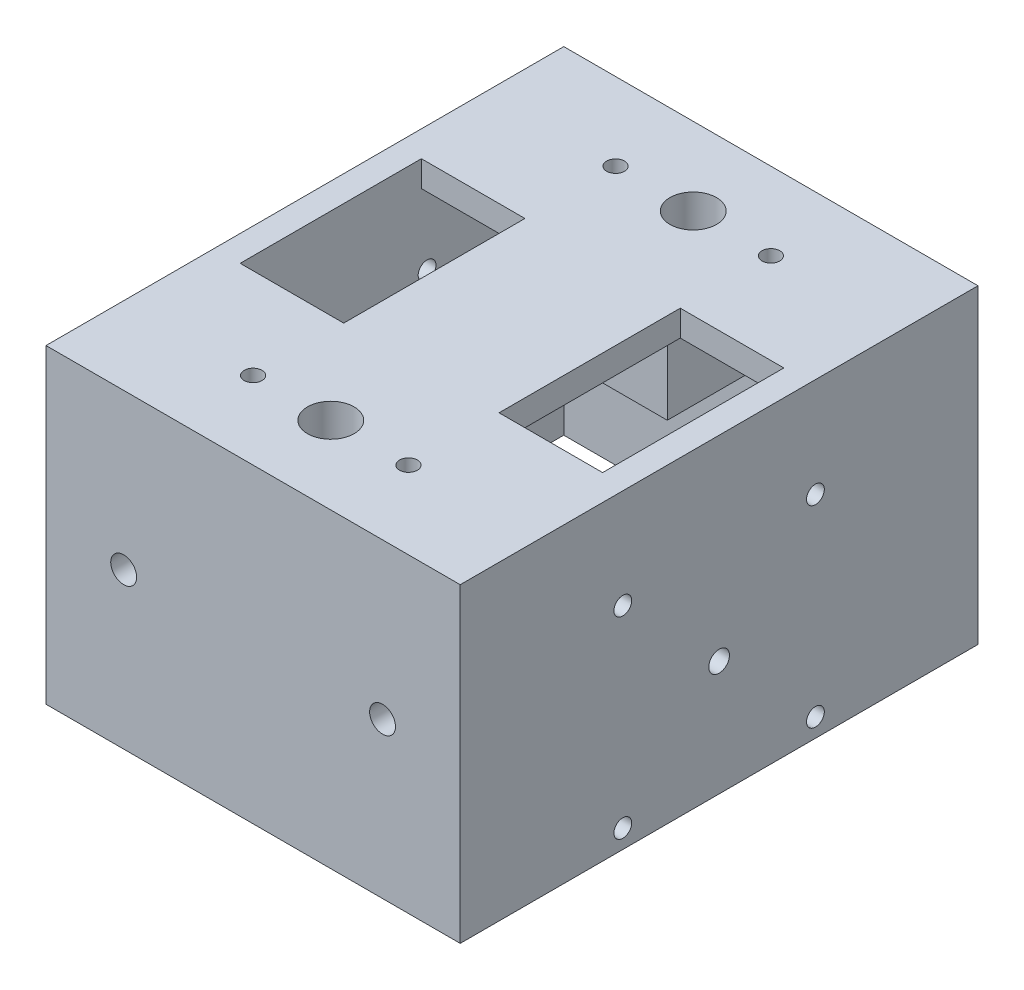
from build123d import *

# Parameters (mm, degrees)
SKETCH2_W                            = 101.6
SKETCH2_H                            = 127
BOSS_EXTRUDE1_DEPTH                  = 76.2
SHELL1_T                             = -6.35
F_11_64_0_17188_DIAMETER_HOLE1_D     = 4.365752
F_11_64_0_17188_DIAMETER_HOLE1_DEPTH = 25.4
F_11_64_0_17188_DIAMETER_HOLE1_TIP   = 1.311604225
SKETCH4_R                            = 5.715
CUT_EXTRUDE2_DEPTH                   = 112.44204772
SKETCH6_W                            = 19.05
SKETCH6_H                            = 28.575
SKETCH6_R                            = 5.715
BOSS_EXTRUDE2_DEPTH                  = 25.4
F_11_64_0_17188_DIAMETER_HOLE2_D     = 4.365752
F_11_64_0_17188_DIAMETER_HOLE2_DEPTH = 127
F_11_64_0_17188_DIAMETER_HOLE2_TIP   = 1.311604225
CUT_EXTRUDE3_REACH                   = 143.99
SKETCH9_R                            = 3.81
SKETCH10_W                           = 25.4
SKETCH10_H                           = 44.45
CUT_EXTRUDE5_DEPTH                   = 108.200338152
SKETCH11_R                           = 3.175
CUT_EXTRUDE6_DEPTH                   = 157.576115675
CUT_EXTRUDE7_REACH                   = 143.99
SKETCH13_R                           = 2.54
SKETCH14_W                           = 41.275
SKETCH14_H                           = 41.275
CUT_EXTRUDE8_DEPTH                   = 2.032


with BuildPart() as part:
    # Sketch2 → Boss-Extrude1 (new body)
    with BuildSketch(Plane(origin=(0, 0, 0), x_dir=(1, 0, 0), z_dir=(0, 1, 0))):
        Rectangle(SKETCH2_W, SKETCH2_H)
    extrude(amount=BOSS_EXTRUDE1_DEPTH)

    # Shell1
    shell1_openings = [part.faces().sort_by_distance(p)[0] for p in [
        (0, 0, 0),
    ]]
    offset(amount=SHELL1_T, openings=shell1_openings, kind=Kind.INTERSECTION)

    # 11/64 (0.17188) Diameter Hole1
    with Locations(Plane(origin=(-19.05, 76.2, -44.45), x_dir=(0, 0, 1), z_dir=(0, 1, 0))):
        with Locations((0, 0), (0, 38.1), (88.9, 0), (88.9, 38.1)):
            Hole(F_11_64_0_17188_DIAMETER_HOLE1_D / 2, depth=F_11_64_0_17188_DIAMETER_HOLE1_DEPTH)
            with Locations((0, 0, -(F_11_64_0_17188_DIAMETER_HOLE1_DEPTH + F_11_64_0_17188_DIAMETER_HOLE1_TIP / 2))):  # 118° drill point
                Cone(0, F_11_64_0_17188_DIAMETER_HOLE1_D / 2, F_11_64_0_17188_DIAMETER_HOLE1_TIP, mode=Mode.SUBTRACT)

    # Sketch4 → Cut-Extrude2 (cut, through all)
    with BuildSketch(Plane(origin=(0, 76.2, 0), x_dir=(1, 0, 0), z_dir=(0, 1, 0))):
        with Locations(Location((0, 44.45, 0), (0, 0, 270))):
            Circle(SKETCH4_R)
        with Locations(Location((0, -44.45, 0), (0, 0, 270))):
            Circle(SKETCH4_R)
    extrude(amount=-CUT_EXTRUDE2_DEPTH, mode=Mode.SUBTRACT)

    # Sketch6 → Boss-Extrude2 (add)
    # profile 1 of 2: a face of its own
    with BuildSketch(Plane.XZ.offset(-69.85)):
        with Locations((0, 42.8625)):
            Rectangle(SKETCH6_W, SKETCH6_H)
        with Locations(Location((0, 44.45, 0), (0, 0, 90))):
            Circle(SKETCH6_R, mode=Mode.SUBTRACT)
    # profile 2 of 2: a face of its own
    with BuildSketch(Plane.XZ.offset(-69.85)):
        with Locations((0, -42.8625)):
            Rectangle(SKETCH6_W, SKETCH6_H)
        with Locations(Location((0, -44.45, 0), (0, 0, 90))):
            Circle(SKETCH6_R, mode=Mode.SUBTRACT)
    extrude(amount=BOSS_EXTRUDE2_DEPTH)

    # 11/64 (0.17188) Diameter Hole2
    with Locations(Plane(origin=(-50.8, 51.816, -23.622), x_dir=(0, 0, -1), z_dir=(-1, 0, 0))):
        with Locations((0, 0), (0, 47.244), (-47.244, 0), (-47.244, 47.244)):
            Hole(F_11_64_0_17188_DIAMETER_HOLE2_D / 2, depth=F_11_64_0_17188_DIAMETER_HOLE2_DEPTH)
            with Locations((0, 0, -(F_11_64_0_17188_DIAMETER_HOLE2_DEPTH + F_11_64_0_17188_DIAMETER_HOLE2_TIP / 2))):  # 118° drill point
                Cone(0, F_11_64_0_17188_DIAMETER_HOLE2_D / 2, F_11_64_0_17188_DIAMETER_HOLE2_TIP, mode=Mode.SUBTRACT)

    # Sketch9 → Cut-Extrude3 (cut, up to next)
    with BuildSketch(Plane.ZY.offset(50.8), mode=Mode.PRIVATE) as cut_extrude3_sk1:
        with Locations((0, 28.194)):
            Circle(SKETCH9_R)
    cut_extrude3_tool1 = extrude(cut_extrude3_sk1.sketch, amount=-CUT_EXTRUDE3_REACH, mode=Mode.PRIVATE) & part.part
    add(cut_extrude3_tool1.solids().sort_by_distance((-50.8, 28.194, 0))[0], mode=Mode.SUBTRACT)

    # Sketch10 → Cut-Extrude5 (cut, through all)
    with BuildSketch(Plane(origin=(0, 69.85, 0), x_dir=(-1, 0, 0), z_dir=(0, -1, 0))):
        with Locations((31.75, 0)):
            Rectangle(SKETCH10_W, SKETCH10_H)
        with Locations((-31.75, 0)):
            Rectangle(SKETCH10_W, SKETCH10_H)
    extrude(amount=-CUT_EXTRUDE5_DEPTH, mode=Mode.SUBTRACT)

    # Sketch11 → Cut-Extrude6 (cut, through all)
    with BuildSketch(Plane.XY.offset(63.5)):
        with Locations((-31.75, 38.1)):
            Circle(SKETCH11_R)
        with Locations((31.75, 38.1)):
            Circle(SKETCH11_R)
    extrude(amount=-CUT_EXTRUDE6_DEPTH, mode=Mode.SUBTRACT)

    # Sketch13 → Cut-Extrude7 (cut, up to next)
    with BuildSketch(Plane(origin=(50.8, 0, 0), x_dir=(0, 0, -1), z_dir=(1, 0, 0)), mode=Mode.PRIVATE) as cut_extrude7_sk1:
        with Locations((0, 28.194)):
            Circle(SKETCH13_R)
    cut_extrude7_tool1 = extrude(cut_extrude7_sk1.sketch, amount=-CUT_EXTRUDE7_REACH, mode=Mode.PRIVATE) & part.part
    add(cut_extrude7_tool1.solids().sort_by_distance((50.8, 28.194, 0))[0], mode=Mode.SUBTRACT)

    # Sketch14 → Cut-Extrude8 (cut)
    with BuildSketch(Plane.ZY.offset(50.8)):
        with Locations((0, 28.194)):
            Rectangle(SKETCH14_W, SKETCH14_H)
    extrude(amount=-CUT_EXTRUDE8_DEPTH, mode=Mode.SUBTRACT)


solid = part.part
